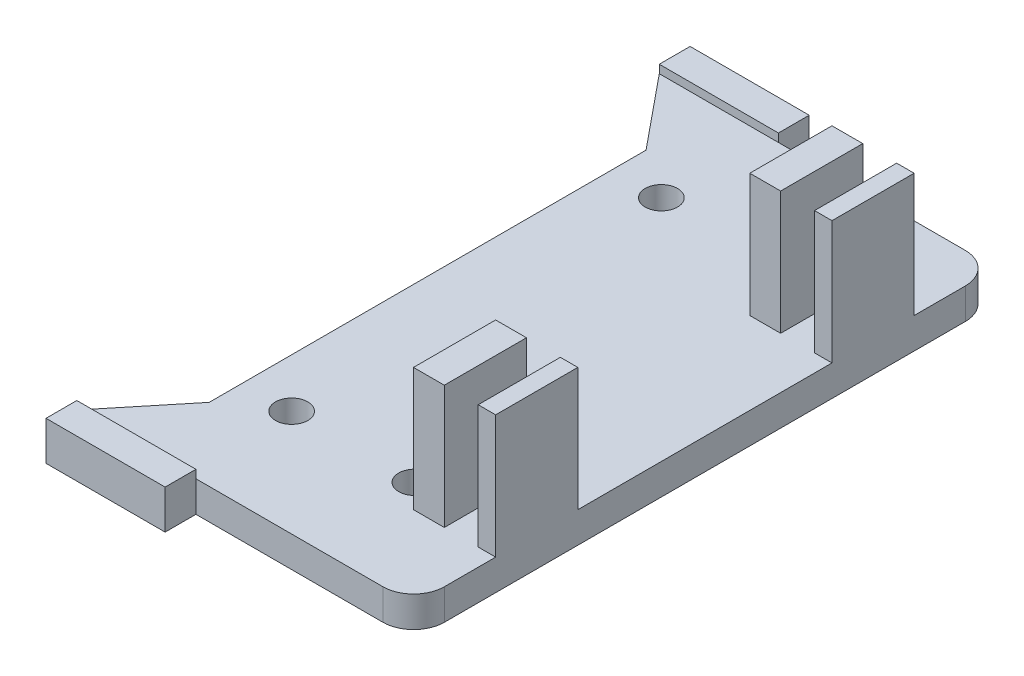
from build123d import *

# Parameters (mm, degrees)
SKETCH1_R           = 1.575
SKETCH1_W           = 3
SKETCH1_H           = 8
BOSS_EXTRUDE1_DEPTH = 3
SKETCH1_3_W         = 3
SKETCH1_3_H         = 8
SKETCH1_3_W_2       = 1.7
BOSS_EXTRUDE2_DEPTH = 15
SKETCH1_4_W         = 11.6
SKETCH1_4_H         = 3
BOSS_EXTRUDE3_DEPTH = 3.8
FILLET1_R           = 3


with BuildPart() as part:
    # Sketch1 → Boss-Extrude1 (new body)
    with BuildSketch(Plane(origin=(0, 0, 0), x_dir=(1, 0, 0), z_dir=(0, 1, 0))):
        Polygon((-13.5, -21.27), (-19.3, -28.36), (13.5, -28.36), (13.5, -20.375), (11.8, -20.375), (11.8, -12.375), (13.5, -12.375), (13.5, 12.375), (11.8, 12.375), (11.8, 20.375), (13.5, 20.375), (13.5, 28.36), (-19.3, 28.36), (-13.5, 21.27), align=None)
        with Locations((-8.738402562, -18)):
            Circle(SKETCH1_R, mode=Mode.SUBTRACT)
        with Locations((3.261597438, -18)):
            Circle(SKETCH1_R, mode=Mode.SUBTRACT)
        with Locations((7, -16.375)):
            Rectangle(SKETCH1_W, SKETCH1_H, mode=Mode.SUBTRACT)
        with Locations((7, 16.375)):
            Rectangle(SKETCH1_W, SKETCH1_H, mode=Mode.SUBTRACT)
        with Locations((-8.738402562, 18)):
            Circle(SKETCH1_R, mode=Mode.SUBTRACT)
        with Locations((3.261597438, 18)):
            Circle(SKETCH1_R, mode=Mode.SUBTRACT)
    extrude(amount=BOSS_EXTRUDE1_DEPTH)

    # Sketch1<3> → Boss-Extrude2 (add)
    with BuildSketch(Plane(origin=(0, 0, 0), x_dir=(1, 0, 0), z_dir=(0, 1, 0))):
        with Locations((7, -16.375)):
            Rectangle(SKETCH1_3_W, SKETCH1_3_H)
        with Locations((12.65, -16.375)):
            Rectangle(SKETCH1_3_W_2, SKETCH1_3_H)
        with Locations((12.65, 16.375)):
            Rectangle(SKETCH1_3_W_2, SKETCH1_3_H)
        with Locations((7, 16.375)):
            Rectangle(SKETCH1_3_W, SKETCH1_3_H)
    extrude(amount=BOSS_EXTRUDE2_DEPTH)

    # Sketch1<4> → Boss-Extrude3 (add)
    with BuildSketch(Plane(origin=(0, 0, 0), x_dir=(1, 0, 0), z_dir=(0, 1, 0))):
        with Locations((-13.5, -29.86)):
            Rectangle(SKETCH1_4_W, SKETCH1_4_H)
        with Locations((-13.5, 29.86)):
            Rectangle(SKETCH1_4_W, SKETCH1_4_H)
    extrude(amount=BOSS_EXTRUDE3_DEPTH)

    # Fillet1
    fillet1_edges = [part.edges().sort_by_distance(p)[0] for p in [
        (13.5, 1.5, -28.36),
        (13.5, 1.5, 28.36),
    ]]
    fillet(fillet1_edges, radius=FILLET1_R)


solid = part.part
